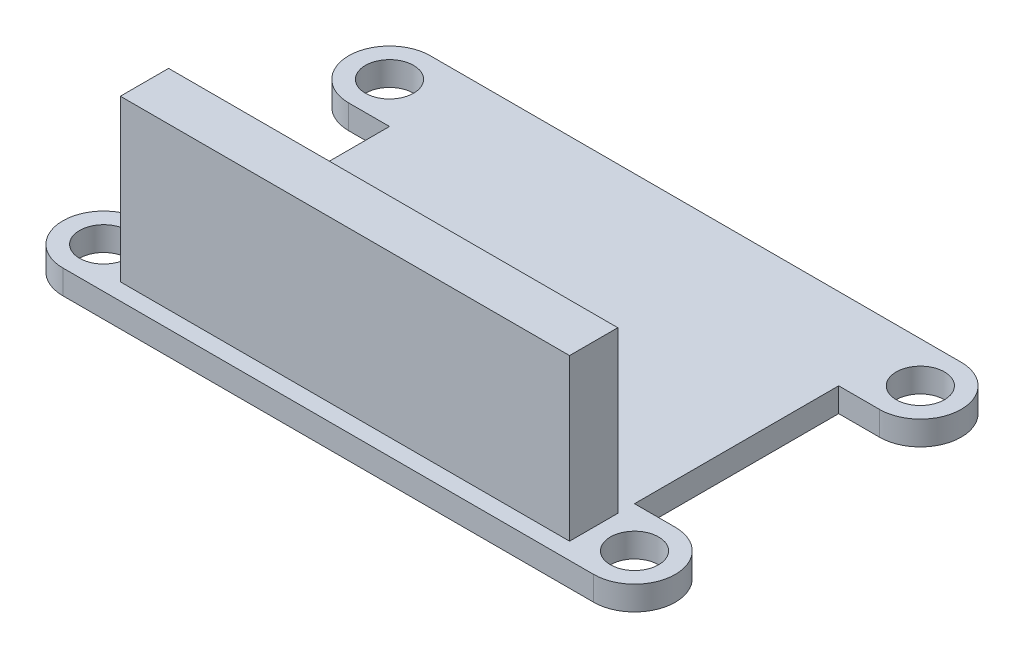
from build123d import *

# Parameters (mm, degrees)
SKETCH_1_R      = 1.5
EXTRUDE_1_DEPTH = 1.5
SKETCH_2_W      = 27.94
SKETCH_2_H      = 3
EXTRUDE_2_DEPTH = 10


with BuildPart() as part:
    # Эскиз1 → Бобышка-Вытянуть1 (new body)
    with BuildSketch(Plane(origin=(0, 0, 0), x_dir=(1, 0, 0), z_dir=(0, 1, 0))):
        with BuildLine():
            ThreePointArc((35.56, 22.86), (38.1, 20.32), (35.56, 17.78))
            Line((35.56, 17.78), (33.02, 17.78))
            Line((33.02, 17.78), (33.02, 5.08))
            Line((33.02, 5.08), (35.56, 5.08))
            ThreePointArc((35.56, 5.08), (38.1, 2.54), (35.56, 0))
            Line((35.56, 0), (2.54, 0))
            ThreePointArc((2.54, 0), (0, 2.54), (2.54, 5.08))
            Line((2.54, 5.08), (5.08, 5.08))
            Line((5.08, 5.08), (5.08, 17.78))
            Line((5.08, 17.78), (2.54, 17.78))
            ThreePointArc((2.54, 17.78), (0, 20.32), (2.54, 22.86))
            Line((2.54, 22.86), (35.56, 22.86))
        make_face()
        with Locations(Location((35.56, 2.54, 0), (0, 0, 270))):
            Circle(SKETCH_1_R, mode=Mode.SUBTRACT)
        with Locations(Location((2.54, 2.54, 0), (0, 0, 270))):
            Circle(SKETCH_1_R, mode=Mode.SUBTRACT)
        with Locations(Location((2.54, 20.32, 0), (0, 0, 270))):
            Circle(SKETCH_1_R, mode=Mode.SUBTRACT)
        with Locations(Location((35.56, 20.32, 0), (0, 0, 270))):
            Circle(SKETCH_1_R, mode=Mode.SUBTRACT)
    extrude(amount=EXTRUDE_1_DEPTH)

    # Эскиз2 → Бобышка-Вытянуть2 (add)
    with BuildSketch(Plane(origin=(0, 1.5, 0), x_dir=(1, 0, 0), z_dir=(0, 1, 0))):
        with Locations((19.05, 2.54)):
            Rectangle(SKETCH_2_W, SKETCH_2_H)
    extrude(amount=EXTRUDE_2_DEPTH)


solid = part.part
